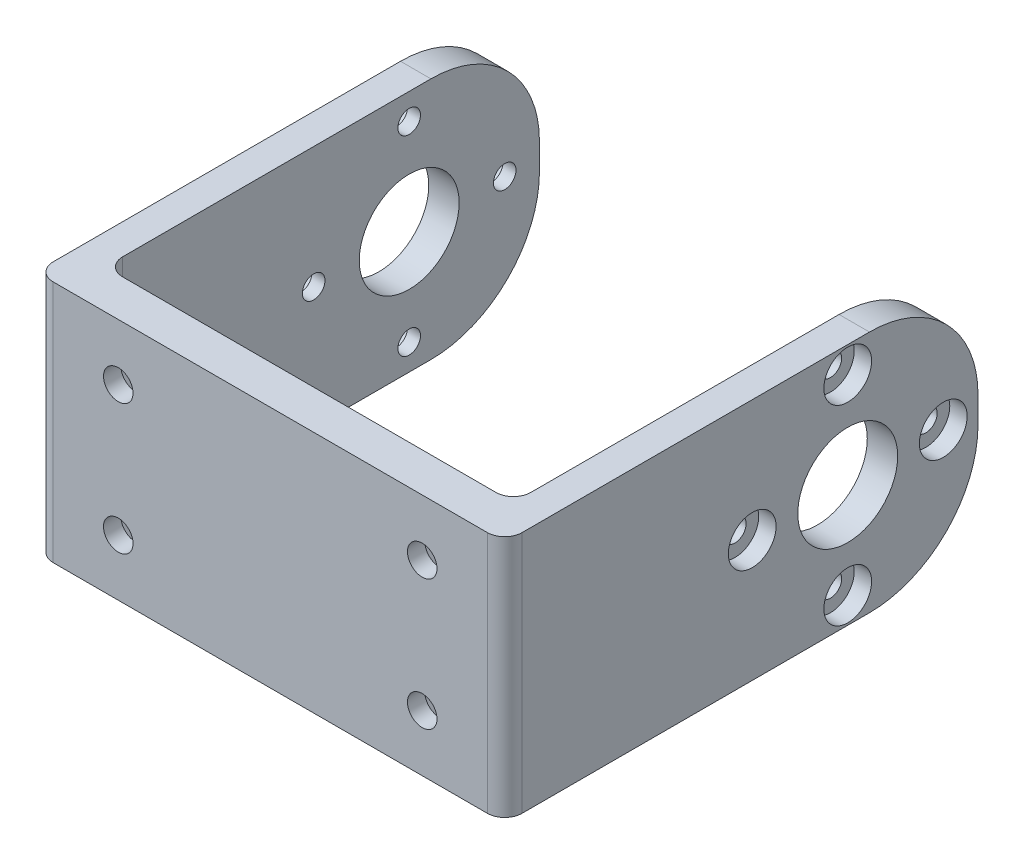
from build123d import *

# Parameters (mm, degrees)
BOSS_EXTRUDE1_DEPTH = 28
SKETCH3_R           = 5.75
SKETCH3_R_2         = 1.3
CUT_EXTRUDE1_DEPTH  = 79.74007874
SKETCH4_R           = 1.7
CUT_EXTRUDE2_DEPTH  = 25
FILLET1_R           = 2
FILLET2_R           = 12.5
CUT_EXTRUDE3_DEPTH  = 2.5
SKETCH6_R           = 2.75
CUT_EXTRUDE4_DEPTH  = 2
CUT_EXTRUDE5_START  = -2
SKETCH9_R           = 2.75
CUT_EXTRUDE5_DEPTH  = 2


with BuildPart() as part:
    # Sketch1 → Boss-Extrude1 (new body)
    with BuildSketch(Plane(origin=(0, 0, 0), x_dir=(1, 0, 0), z_dir=(0, 1, 0))):
        Polygon((-27, 50), (-27, -4.5), (27, -4.5), (27, 50), (23.5, 50), (23.5, 0), (-23.5, 0), (-23.5, 50), align=None)
    extrude(amount=BOSS_EXTRUDE1_DEPTH)

    # Sketch3 → Cut-Extrude1 (cut, through all)
    with BuildSketch(Plane(origin=(27, 0, 0), x_dir=(0, 0, -1), z_dir=(1, 0, 0))):
        with Locations((35, 14)):
            Circle(SKETCH3_R)
        with Locations((46, 14)):
            Circle(SKETCH3_R_2)
        with Locations((35, 3)):
            Circle(SKETCH3_R_2)
        with Locations((24, 14)):
            Circle(SKETCH3_R_2)
        with Locations((35, 25)):
            Circle(SKETCH3_R_2)
    extrude(amount=-CUT_EXTRUDE1_DEPTH, mode=Mode.SUBTRACT)

    # Sketch4 → Cut-Extrude2 (cut)
    with BuildSketch(Plane.XY.offset(4.5)):
        with Locations((-17.5, 6.5)):
            Circle(SKETCH4_R)
        with Locations((17.5, 6.5)):
            Circle(SKETCH4_R)
        with Locations((17.5, 21.5)):
            Circle(SKETCH4_R)
        with Locations((-17.5, 21.5)):
            Circle(SKETCH4_R)
    extrude(amount=-CUT_EXTRUDE2_DEPTH, mode=Mode.SUBTRACT)

    # Fillet1
    fillet1_edges = [part.edges().sort_by_distance(p)[0] for p in [
        (-23.5, 14, 0),
        (23.5, 14, 0),
        (27, 14, 4.5),
        (-27, 14, 4.5),
    ]]
    fillet(fillet1_edges, radius=FILLET1_R)

    # Fillet2
    fillet2_edges = [part.edges().sort_by_distance(p)[0] for p in [
        (-25.25, 0, -50),
        (25.25, 28, -50),
        (-25.25, 28, -50),
        (25.25, 0, -50),
    ]]
    fillet(fillet2_edges, radius=FILLET2_R)

    # Sketch5 → Cut-Extrude3 (cut)
    with BuildSketch(Plane(origin=(0, 0, 0), x_dir=(-1, 0, 0), z_dir=(0, 0, -1))):
        Polygon((19.174315781, 18.6), (20.848631561, 21.5), (19.174315781, 24.4), (15.825684219, 24.4), (14.151368439, 21.5), (15.825684219, 18.6), align=None)
        Polygon((-15.825684219, 18.6), (-14.151368439, 21.5), (-15.825684219, 24.4), (-19.174315781, 24.4), (-20.848631561, 21.5), (-19.174315781, 18.6), align=None)
        Polygon((19.174315781, 3.6), (20.848631561, 6.5), (19.174315781, 9.4), (15.825684219, 9.4), (14.151368439, 6.5), (15.825684219, 3.6), align=None)
        Polygon((-15.825684219, 3.6), (-14.151368439, 6.5), (-15.825684219, 9.4), (-19.174315781, 9.4), (-20.848631561, 6.5), (-19.174315781, 3.6), align=None)
    extrude(amount=-CUT_EXTRUDE3_DEPTH, mode=Mode.SUBTRACT)

    # Sketch6 → Cut-Extrude4 (cut)
    with BuildSketch(Plane(origin=(27, 0, 0), x_dir=(0, 0, -1), z_dir=(1, 0, 0))):
        with Locations((24, 14)):
            Circle(SKETCH6_R)
        with Locations((35, 25)):
            Circle(SKETCH6_R)
        with Locations((46, 14)):
            Circle(SKETCH6_R)
        with Locations((35, 3)):
            Circle(SKETCH6_R)
    extrude(amount=-CUT_EXTRUDE4_DEPTH, mode=Mode.SUBTRACT)

    # Sketch9 → Cut-Extrude5 (cut)
    with BuildSketch(Plane.ZY.offset(27).offset(CUT_EXTRUDE5_START)):
        with Locations(Location((-46, 14, 0), (0, 0, 180))):
            Circle(SKETCH9_R)
        with Locations(Location((-35, 25, 0), (0, 0, 180))):
            Circle(SKETCH9_R)
        with Locations(Location((-24, 14, 0), (0, 0, 180))):
            Circle(SKETCH9_R)
        with Locations(Location((-35, 3, 0), (0, 0, 180))):
            Circle(SKETCH9_R)
    extrude(amount=CUT_EXTRUDE5_DEPTH, mode=Mode.SUBTRACT)


solid = part.part
